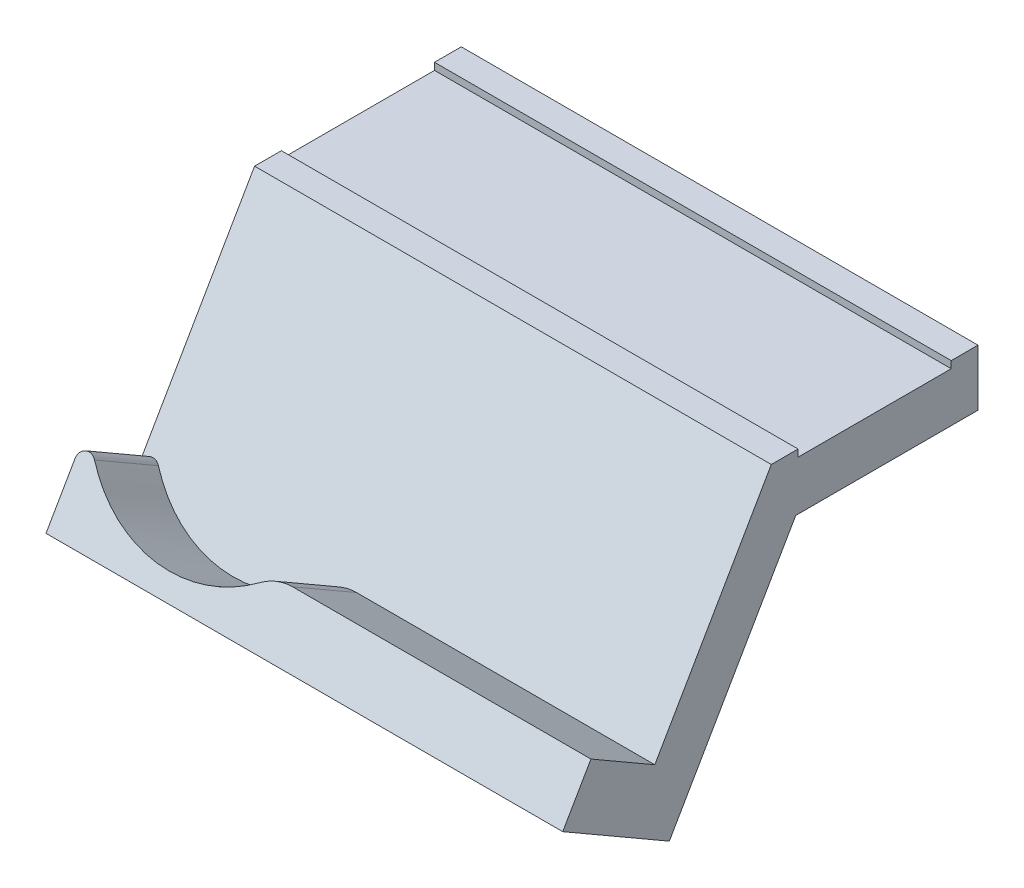
from build123d import *

# Parameters (mm, degrees)
BOSS_EXTRUDE1_DEPTH = 80
CUT_EXTRUDE1_DEPTH  = 50
CUT_EXTRUDE2_DEPTH  = 101.49080803735235
BOSS_EXTRUDE2_REACH = 102.491
CUT_EXTRUDE10_DEPTH = 50
SKETCH6_R           = 13.750000000000007
CUT_EXTRUDE3_DEPTH  = 102.06821275824429
CUT_EXTRUDE4_DEPTH  = 101.49080803735237
SKETCH8_R           = 6.000000000000003
CUT_EXTRUDE5_DEPTH  = 73.15845701593427
CUT_EXTRUDE6_DEPTH  = 73.15845701593429
CUT_EXTRUDE7_DEPTH  = 69.27999960632745
FILLET5_R           = 1
FILLET6_R           = 5
CUT_EXTRUDE8_DEPTH  = 67.6997627150144
BOSS_EXTRUDE4_DEPTH = 22
BOSS_EXTRUDE5_DEPTH = 55
CUT_EXTRUDE9_DEPTH  = 0.75
BOSS_EXTRUDE6_DEPTH = 55


with BuildPart() as part:
    # Sketch1 → Boss-Extrude1 (new body)
    with BuildSketch(Plane(origin=(0, 0, 0), x_dir=(1, 0, 0), z_dir=(0, 1, 0))):
        Polygon((-1e-17, 25.95), (55, 25.95), (55.00000000000001, 0), (0, 0), align=None)
    extrude(amount=BOSS_EXTRUDE1_DEPTH)

    # Sketch4 → Cut-Extrude1 (cut)
    with BuildSketch(Plane(origin=(55.00000000000001, 0, -1.471e-14), x_dir=(0, 0, -1), z_dir=(1, 0, 0))):
        Polygon((-77.30254037844365, 60.0000000000004), (-27.30254037844327, 146.60254037844405), (59.300000000000374, 96.60254037844365), (9.299999999999985, 9.999999999999995), align=None)
    extrude(amount=-CUT_EXTRUDE1_DEPTH, mode=Mode.SUBTRACT)

    # Sketch5 → Cut-Extrude2 (cut, through all)
    with BuildSketch(Plane(origin=(55.00000000000001, 0, -1.471e-14), x_dir=(0, 0, -1), z_dir=(1, 0, 0))):
        Polygon((-11.160254037844386, 10.265727792645105), (-6.160254037844387, 18.92598183048949), (2.4999999999999942, 13.925981830489496), (-2.499999999999998, 5.265727792645102), align=None)
    extrude(amount=-CUT_EXTRUDE2_DEPTH, mode=Mode.SUBTRACT)

    # Sketch12 → Boss-Extrude2 (add, up to next)
    with BuildSketch(Plane(origin=(55.00000000000001, 0, -1.471e-14), x_dir=(0, 0, -1), z_dir=(1, 0, 0)), mode=Mode.PRIVATE) as boss_extrude2_sk1:
        Polygon((2.4999999999999942, 13.925981830489496), (9.299999999999985, 9.999999999999995), (9.800000000000008, 10.866025403784473), (2.9999999999999933, 14.792007234273935), align=None)
    boss_extrude2_tool1 = extrude(boss_extrude2_sk1.sketch, amount=-BOSS_EXTRUDE2_REACH, mode=Mode.PRIVATE) - part.part
    add(boss_extrude2_tool1.solids().sort_by_distance((55, 12.396004, -6.15))[0])

    # Sketch21 → Cut-Extrude10 (cut)
    with BuildSketch(Plane(origin=(55.00000000000001, 0, -1.471e-14), x_dir=(-2.7e-16, 0, -1), z_dir=(1, 0, -2.7e-16))):
        Polygon((3.0000000000000075, 14.792007234273937), (2.2500000000000036, 13.49296912859728), (9.050000000000018, 9.566987298107822), (9.800000000000008, 10.866025403784464), align=None)
    extrude(amount=-CUT_EXTRUDE10_DEPTH, mode=Mode.SUBTRACT)

    # Sketch6 → Cut-Extrude3 (cut, through all)
    with BuildSketch(Plane(origin=(0, -1.5270181275976227, -2.6448729810777505), x_dir=(1, 0, 0), z_dir=(0, 0.5000000000000042, 0.8660254037844363))):
        with Locations((12.000000000000004, 22.810254037844377)):
            Circle(SKETCH6_R)
    extrude(amount=CUT_EXTRUDE3_DEPTH, mode=Mode.SUBTRACT)

    # Sketch7 → Cut-Extrude4 (cut, through all)
    with BuildSketch(Plane(origin=(55.00000000000001, 0, -1.471e-14), x_dir=(0, 0, -1), z_dir=(1, 0, 0))):
        Polygon((-1.613e-14, 9.595854811567275), (3.8935696044755734, 16.339715189324856), (10.693569604475588, 12.413733358835394), (66.80169358562932, 109.59585481156728), (25.408423261372093, 109.59585481156728), (-1e-17, 109.59585481156728), align=None)
    extrude(amount=-CUT_EXTRUDE4_DEPTH, mode=Mode.SUBTRACT)

    # Sketch8 → Cut-Extrude5 (cut, through all)
    with BuildSketch(Plane(origin=(0, 0, 0), x_dir=(1, 0, 0), z_dir=(0, 1, 0))):
        with Locations((25.749999999999996, 27.449999999999996)):
            Circle(SKETCH8_R)
    extrude(amount=CUT_EXTRUDE5_DEPTH, mode=Mode.SUBTRACT)

    # Sketch9 → Cut-Extrude6 (cut, through all)
    with BuildSketch(Plane(origin=(55.00000000000001, 0, -1.471e-14), x_dir=(0, 0, -1), z_dir=(1, 0, 0))):
        Polygon((21.449999999999978, 31.044417311961634), (25.94999999999998, 31.044417311961634), (25.94999999999998, 38.8386459460215), align=None)
    extrude(amount=-CUT_EXTRUDE6_DEPTH, mode=Mode.SUBTRACT)

    # Sketch10 → Cut-Extrude7 (cut, through all)
    with BuildSketch(Plane(origin=(0, 0, 0), x_dir=(1, 0, 0), z_dir=(0, 1, 0))):
        Polygon((55.00000000000001, 21.449999999999992), (0, 21.449999999999996), (0, 25.94999999999999), (55.00000000000001, 25.949999999999992), align=None)
    extrude(amount=CUT_EXTRUDE7_DEPTH, mode=Mode.SUBTRACT)

    # Fillet5
    fillet5_edges = [part.edges().sort_by_distance(p)[0] for p in [
        (0, 14.37672427408014, -7.293569604475611),
    ]]
    fillet(fillet5_edges, radius=FILLET5_R)

    # Fillet6
    fillet6_edges = [part.edges().sort_by_distance(p)[0] for p in [
        (21.437293044088527, 11.52997821335257, -5.650000000000027),
    ]]
    fillet(fillet6_edges, radius=FILLET6_R)

    # Sketch16 → Cut-Extrude8 (cut, through all)
    with BuildSketch(Plane(origin=(55.00000000000001, 0, -1.471e-14), x_dir=(0, 0, -1), z_dir=(1, 0, 0))):
        Polygon((21.44999999999998, 20.54441731196163), (11.346633369868394, 3.04487298107776), (-1.613e-14, 9.595854811567275), (1.8e-15, 0), (21.44999999999998, 0), align=None)
    extrude(amount=-CUT_EXTRUDE8_DEPTH, mode=Mode.SUBTRACT)

    # Sketch17 → Boss-Extrude4 (add)
    with BuildSketch(Plane(origin=(1.35e-15, 0, -21.449999999999996), x_dir=(-1, 0, 0), z_dir=(0, 0, -1))):
        Polygon((-55.00000000000001, 31.044417311961634), (1.35e-15, 31.044417311961634), (7.2e-16, 25.044417311961638), (-55.00000000000001, 25.044417311961638), align=None)
    extrude(amount=BOSS_EXTRUDE4_DEPTH)

    # Sketch18 → Boss-Extrude5 (add)
    with BuildSketch(Plane(origin=(55.00000000000001, 0, -1.471e-14), x_dir=(-2.4e-16, 0, -1), z_dir=(1, 0, -2.4e-16))):
        Polygon((16.39831668493419, 11.794645146519695), (27.51217782649105, 31.044417311961634), (21.449999999999978, 31.044417311961634), (11.8516833150658, 14.419645146519745), align=None)
    extrude(amount=-BOSS_EXTRUDE5_DEPTH)

    # Sketch19 → Cut-Extrude9 (cut)
    with BuildSketch(Plane(origin=(0, 31.044417311961634, 0), x_dir=(1, 0, 0), z_dir=(0, 1, 0))):
        Polygon((1e-15, 40.599999999999994), (55.00000000000001, 40.6), (55.00000000000001, 24.29999999999999), (2e-15, 24.29999999999999), align=None)
    extrude(amount=-CUT_EXTRUDE9_DEPTH, mode=Mode.SUBTRACT)

    # Sketch20 → Boss-Extrude6 (add)
    with BuildSketch(Plane(origin=(55.00000000000001, 0, -1.471e-14), x_dir=(-2.4e-16, 0, -1), z_dir=(1, 0, -2.4e-16))):
        Polygon((-1.613e-14, 9.595854811567275), (-0.7500000000000167, 8.296816705890615), (10.59663336986839, 1.7458348754011042), (11.346633369868393, 3.04487298107776), align=None)
    extrude(amount=-BOSS_EXTRUDE6_DEPTH)


solid = part.part
